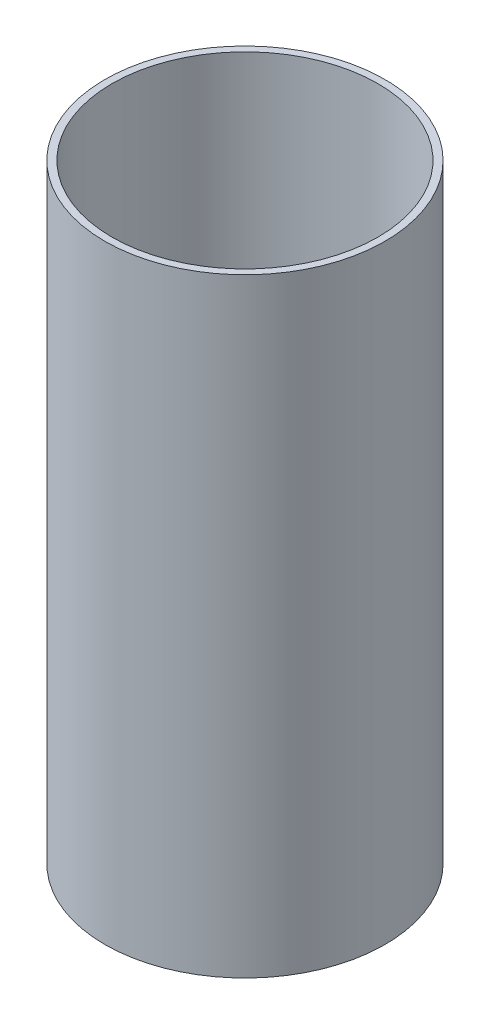
from build123d import *

# Parameters (mm, degrees)
SKETCH1_R           = 93.6625
SKETCH1_R_2         = 88.9
BOSS_EXTRUDE1_DEPTH = 203.581


with BuildPart() as part:
    # Sketch1 → Boss-Extrude1 (new, symmetric)
    with BuildSketch(Plane(origin=(0, 0, 0), x_dir=(1, 0, 0), z_dir=(0, 1, 0))):
        with Locations(Location((0, 0, 0), (0, 0, 270))):
            Circle(SKETCH1_R)
        with Locations(Location((0, 0, 0), (0, 0, 270))):
            Circle(SKETCH1_R_2, mode=Mode.SUBTRACT)
    extrude(amount=BOSS_EXTRUDE1_DEPTH, both=True)


solid = part.part
